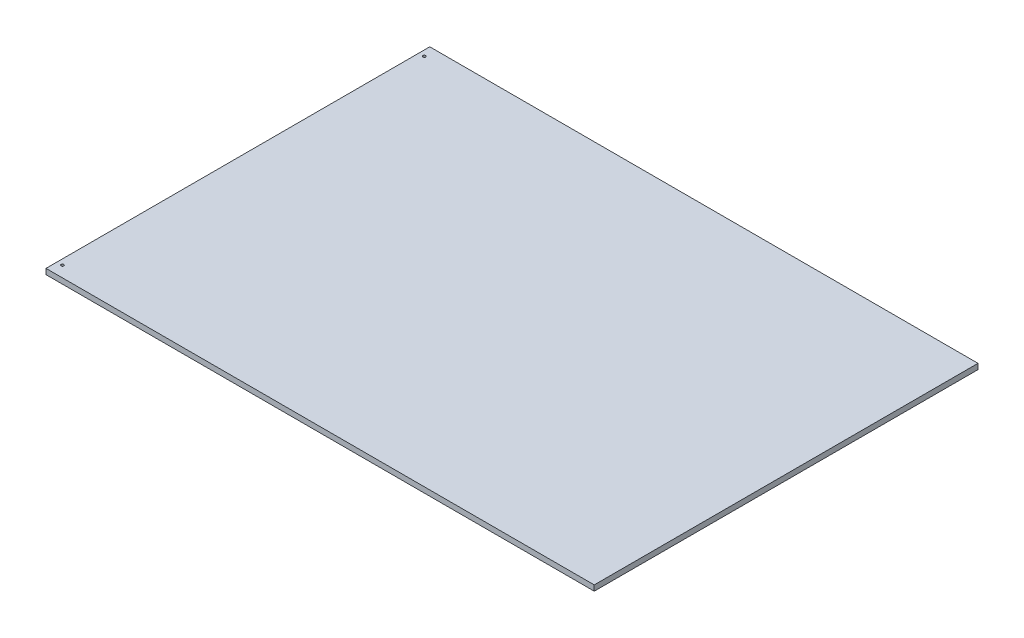
from build123d import *

# Parameters (mm, degrees)
SKETCH1_W           = 1270
SKETCH1_H           = 889
BOSS_EXTRUDE1_DEPTH = 12.7
SKETCH2_R           = 3.175
CUT_EXTRUDE2_DEPTH  = 1222.502


with BuildPart() as part:
    # Sketch1 → Boss-Extrude1 (new body)
    with BuildSketch(Plane(origin=(0, 0, 0), x_dir=(1, 0, 0), z_dir=(0, 1, 0))):
        with Locations((635, 444.5)):
            Rectangle(SKETCH1_W, SKETCH1_H)
    extrude(amount=BOSS_EXTRUDE1_DEPTH)

    # Sketch2 → Cut-Extrude2 (cut)
    with BuildSketch(Plane(origin=(0, 12.7, 0), x_dir=(1, 0, 0), z_dir=(0, 1, 0))):
        with Locations(Location((12.7, 863.6, 0), (0, 0, 270))):
            Circle(SKETCH2_R)
        with Locations(Location((12.7, 25.4, 0), (0, 0, 90))):
            Circle(SKETCH2_R)
    extrude(amount=-CUT_EXTRUDE2_DEPTH, mode=Mode.SUBTRACT)


solid = part.part
